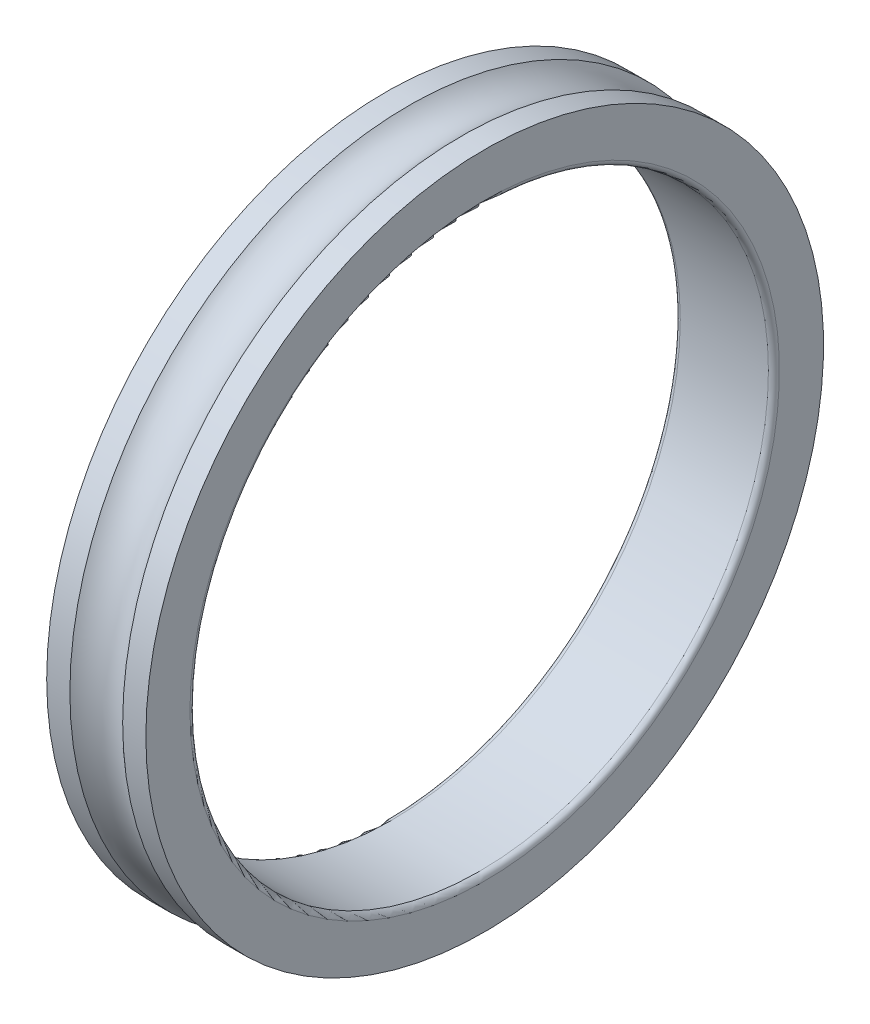
from build123d import *


with BuildPart() as part:
    # Schizzo1 → Rivoluzione1 (revolve)
    with BuildSketch(Plane.XY, mode=Mode.PRIVATE) as rivoluzione1_sk:
        with BuildLine():
            Line((1, 52.5), (17, 52.5))
            ThreePointArc((17, 52.5), (17.707106781, 52.792893219), (18, 53.5))
            Line((18, 53.5), (18, 61.5))
            Line((18, 61.5), (13.791608185, 61.5))
            ThreePointArc((13.791608185, 61.5), (9, 59.503), (4.208391815, 61.5))
            Line((4.208391815, 61.5), (0, 61.5))
            Line((0, 61.5), (0, 53.5))
            ThreePointArc((0, 53.5), (0.292893219, 52.792893219), (1, 52.5))
        make_face()
    revolve(rivoluzione1_sk.sketch.rotate(Axis((50, 0, 0), (-1, 0, 0)), 270), axis=Axis((50, 0, 0), (-1, 0, 0)))


solid = part.part
